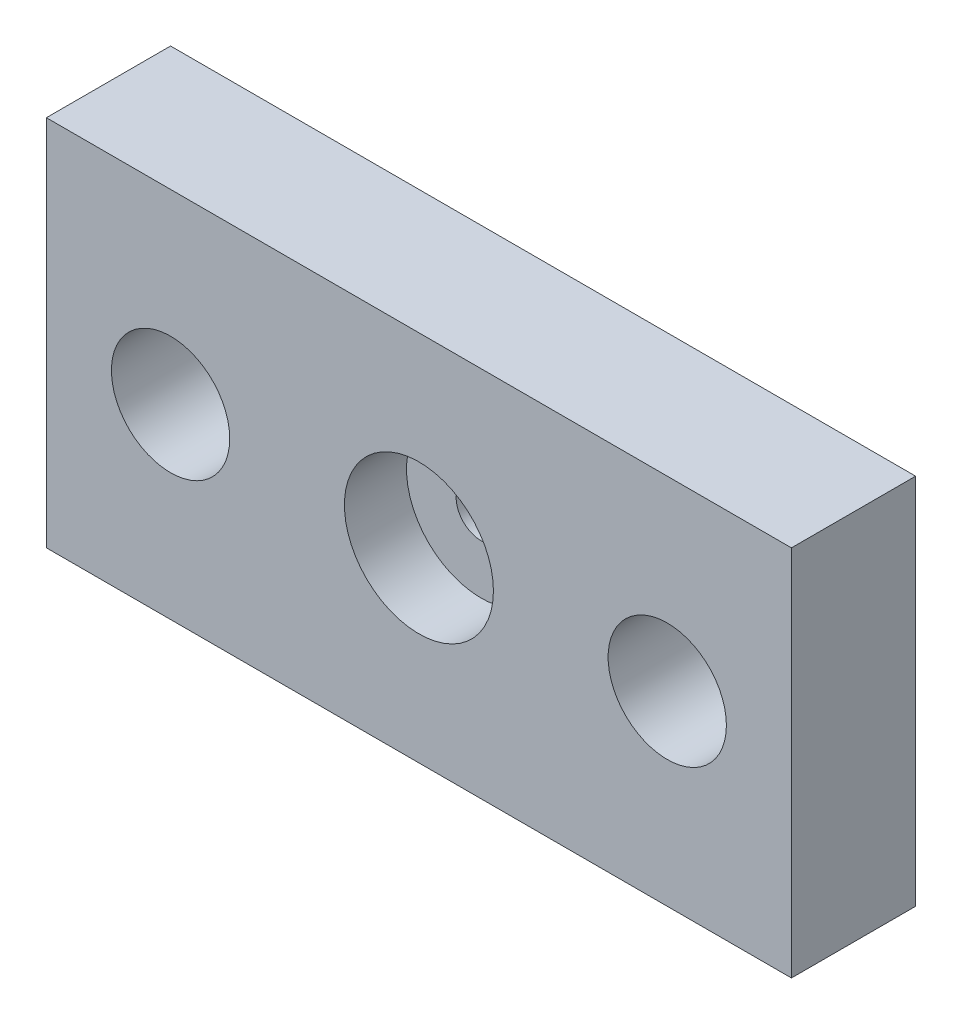
from build123d import *

# Parameters (mm, degrees)
SKETCH1_W           = 30
SKETCH1_H           = 15
SKETCH1_R           = 1
SKETCH1_R_2         = 2.38125
BOSS_EXTRUDE1_DEPTH = 5
SKETCH2_R           = 3
CUT_EXTRUDE1_DEPTH  = 2.5


with BuildPart() as part:
    # Sketch1 → Boss-Extrude1 (new body)
    with BuildSketch(Plane.XY):
        Rectangle(SKETCH1_W, SKETCH1_H)
        Circle(SKETCH1_R, mode=Mode.SUBTRACT)
        with Locations((10, 0)):
            Circle(SKETCH1_R_2, mode=Mode.SUBTRACT)
        with Locations((-10, 0)):
            Circle(SKETCH1_R_2, mode=Mode.SUBTRACT)
    extrude(amount=BOSS_EXTRUDE1_DEPTH)

    # Sketch2 → Cut-Extrude1 (cut)
    with BuildSketch(Plane.XY.offset(5)):
        Circle(SKETCH2_R)
    extrude(amount=-CUT_EXTRUDE1_DEPTH, mode=Mode.SUBTRACT)


solid = part.part
